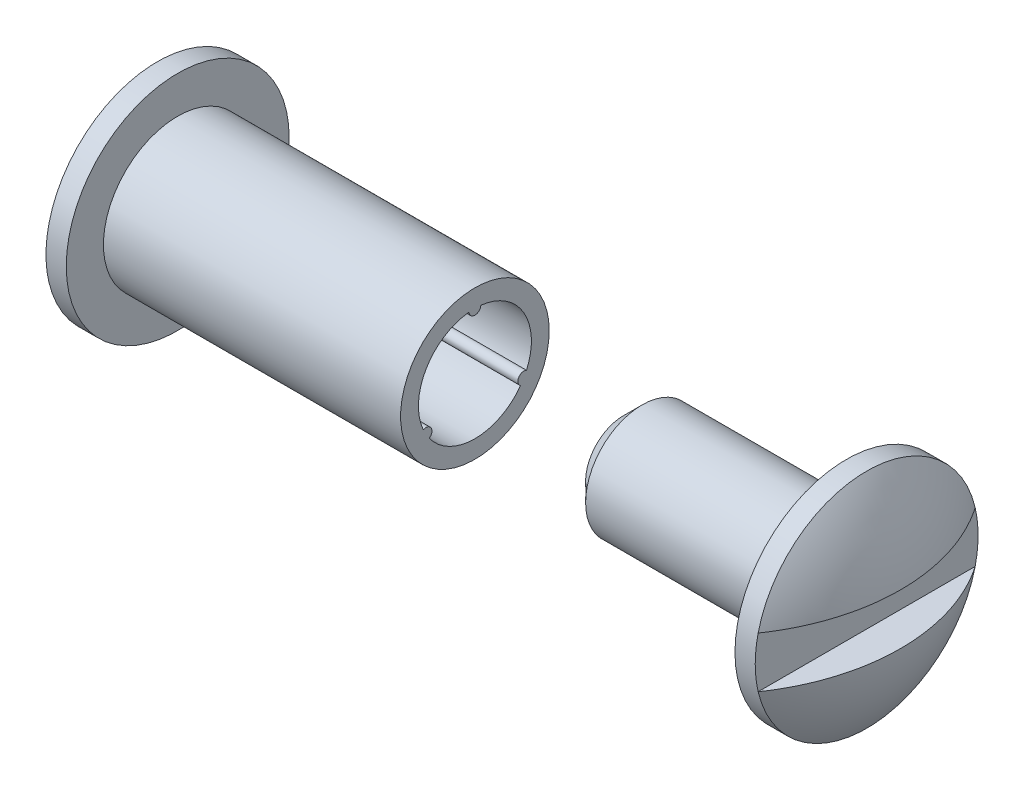
from build123d import *

# Parameters (mm, degrees)
SKETCH2_R           = 2.413
BOSS_EXTRUDE1_DEPTH = 9.525
CHAMFER1_SIZE       = 0.79375
SKETCH17_W          = 9.525
SKETCH17_H          = 2.1717
CUT_EXTRUDE5_DEPTH  = 1.514533
BOSS_EXTRUDE3_REACH = 21.39
SKETCH11_R          = 3.175


with BuildPart() as part:
    # Sketch2 → Boss-Extrude1 (new body)
    with BuildSketch(Plane(origin=(0, 0, 0), x_dir=(0, 0, -1), z_dir=(1, 0, 0))):
        with Locations(Location((0, 0, 0), (0, 0, 180))):
            Circle(SKETCH2_R)
    extrude(amount=BOSS_EXTRUDE1_DEPTH)

    # Chamfer1
    chamfer1_edges = [part.edges().sort_by_distance(p)[0] for p in [
        (0, 0, -2.413),
    ]]
    chamfer(chamfer1_edges, length=CHAMFER1_SIZE)


with BuildPart() as body_2:
    # Sketch6 → Revolve1 (revolve)
    with BuildSketch(Plane.XY):
        with BuildLine():
            Line((9.525, 0), (9.525, 4.7625))
            Line((9.525, 4.7625), (10.390447273, 4.7625))
            ThreePointArc((10.390447273, 4.7625), (11.517229345, 2.498760474), (11.90498, 0))
            Line((11.90498, 0), (9.525, 0))
        make_face()
    revolve(axis=Axis((9.525, 0, 0), (1, 0, 0)))

    # Sketch17 → Cut-Extrude5 (cut)
    with BuildSketch(Plane(origin=(11.90498, 0, 0), x_dir=(0, 0, -1), z_dir=(1, 0, 0))):
        Rectangle(SKETCH17_W, SKETCH17_H)
    extrude(amount=-CUT_EXTRUDE5_DEPTH, mode=Mode.SUBTRACT)


with BuildPart() as body_3:
    # Mirror1: mirrored copy
    add(body_2.part.mirror(Plane(origin=(-4.7625, 0, 0), x_dir=(0, 0, 1), z_dir=(1, 0, 0))))


with BuildPart() as body_4:

    # Sketch11 → Boss-Extrude3 (new, up to next)
    with BuildSketch(Plane(origin=(-6.35, 0, 0), x_dir=(0, 0, -1), z_dir=(1, 0, 0)), mode=Mode.PRIVATE) as boss_extrude3_sk1:
        Circle(SKETCH11_R)
        with BuildLine():
            ThreePointArc((-0.253647955, 2.399631579), (-2.089719299, 1.2065), (-2.204965885, -0.980150216))
            ThreePointArc((-2.204965885, -0.980150216), (-1.869748847, -1.0795), (-1.951317929, -1.419481363))
            ThreePointArc((-1.951317929, -1.419481363), (0, -2.413), (1.951317929, -1.419481363))
            ThreePointArc((1.951317929, -1.419481363), (1.869748847, -1.0795), (2.204965885, -0.980150216))
            ThreePointArc((2.204965885, -0.980150216), (2.089719299, 1.2065), (0.253647955, 2.399631579))
            ThreePointArc((0.253647955, 2.399631579), (0, 2.159), (-0.253647955, 2.399631579))
        make_face(mode=Mode.SUBTRACT)
    boss_extrude3_tool1 = extrude(boss_extrude3_sk1.sketch, amount=-BOSS_EXTRUDE3_REACH, mode=Mode.PRIVATE) - body_3.part
    add(boss_extrude3_tool1.solids().sort_by_distance((-6.35, 0, 3.085197))[0])

    # Combine1: union body 3
    add(body_3.part)


with BuildPart() as body_2_1:
    add(body_2.part)

    # Combine2: union part
    add(part.part)


solid = Compound([body_4.part, body_2_1.part])
